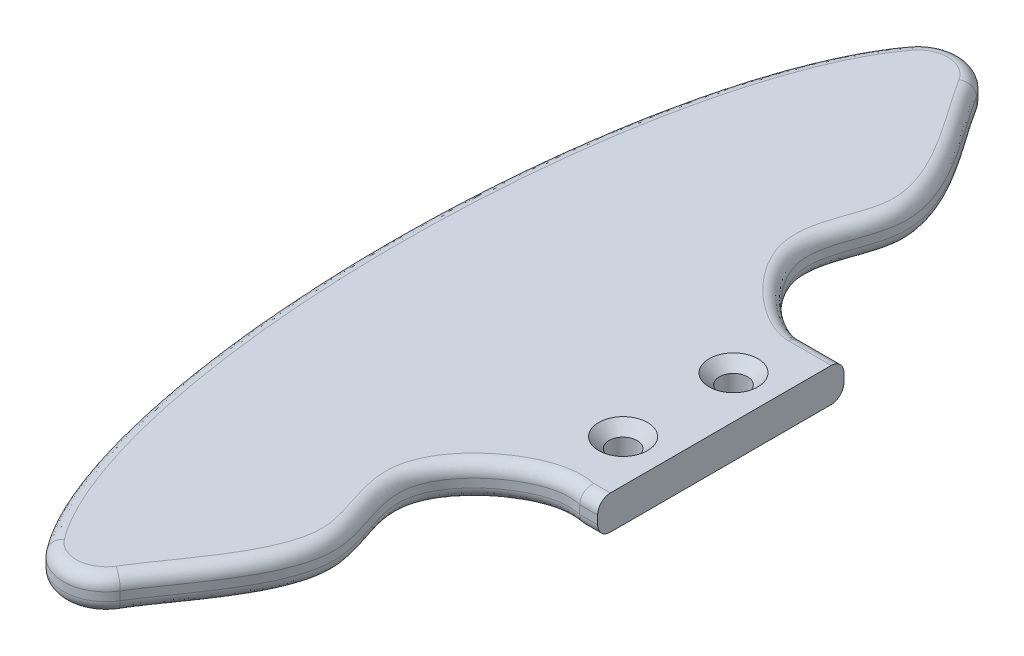
from build123d import *

# Parameters (mm, degrees)
BOSS_EXTRUDE1_DEPTH      = 4
CUT_EXTRUDE3_DEPTH       = 10
FILLET1_R                = 5
FILLET2_R                = 5
FILLET4_R                = 1.5
FILLET5_R                = 1.5
SKETCH8_R                = 1.65
M3_SCREWS_NO_ANGLE_DEPTH = 58.295865217


with BuildPart() as part:
    # Sketch1 → Boss-Extrude1 (new body)
    with BuildSketch(Plane(origin=(0, 0, 0), x_dir=(1, 0, 0), z_dir=(0, 1, 0))):
        with BuildLine():
            Line((16.880887403, -14.5), (21.880887403, -14.5))
            Line((21.880887403, -14.5), (21.880887403, 14.5))
            Line((21.880887403, 14.5), (16.880887403, 14.5))
            add(Edge.make_bspline(
                [(16.880887403, 14.5), (10.315205407, 90.001641988), (-10.061420815, 45.000820994), (-30.438047036, 0), (-10.061420815, -45.000820994), (10.315205407, -90.001641988), (16.880887403, -14.5)],
                knots=[1.837586327, 1.837586327, 1.837586327, 3.754121429, 3.754121429, 5.670656531, 5.670656531, 7.587191634, 7.587191634, 7.587191634], degree=2, weights=[1, 0.574938332, 1, 0.574938332, 1, 0.574938332, 1]))
        make_face()
    extrude(amount=BOSS_EXTRUDE1_DEPTH)

    # Sketch7 → Cut-Extrude3 (cut)
    with BuildSketch(Plane(origin=(0, 4, 0), x_dir=(1, 0, 0), z_dir=(0, 1, 0))):
        with BuildLine():
            add(Edge.make_bspline(
                [(23.14227403, 35.5), (18.099358539, 28.537011918), (23.696184015, 6.625507918), (4.306299207, 22.680417047), (15.57904794, 37.098876778), (-21.537333626, 68.37702066), (62.216195995, 43.763137081), (27.53995378, 41.57208107), (23.14227403, 35.5)],
                knots=[0, 0, 0, 0, 0.169799327, 0.265053464, 0.346195378, 0.531482099, 0.851926319, 1, 1, 1, 1], degree=3))
        make_face()
        with BuildLine():
            add(Edge.make_bspline(
                [(16.880887403, -14.5), (13.197509811, -15.298333146), (4.693966225, -22.34931788), (15.288323023, -37.415470802), (-20.663582176, -66.655050664), (50.291182714, -53.379177777), (30.243329399, -31.220630358), (25.186563856, -12.699832451), (16.880887403, -14.5)],
                knots=[0, 0, 0, 0, 0.097517699, 0.180587821, 0.370277586, 0.69833665, 0.78010659, 1, 1, 1, 1], degree=3))
        make_face()
    extrude(amount=-CUT_EXTRUDE3_DEPTH, mode=Mode.SUBTRACT)

    # Fillet1
    fillet1_edges = [part.edges().sort_by_distance(p)[0] for p in [
        (0, 2, -55),
    ]]
    fillet(fillet1_edges, radius=FILLET1_R)

    # Fillet2
    fillet2_edges = [part.edges().sort_by_distance(p)[0] for p in [
        (0, 2, 55),
    ]]
    fillet(fillet2_edges, radius=FILLET2_R)

    # Fillet4
    fillet4_edges = [part.edges().sort_by_distance(p)[0] for p in [
        (19.380887403, 4, -14.5),
        (20.828164004, 4, 14.5),
        (9.711911079, 4, 31.251065207),
        (-17.499993217, 4, -0.048425363),
        (9.677756323, 4, -31.292902199),
        (-2.456510296, 4, -52.795729821),
        (-2.484255438, 4, 52.73792317),
    ]]
    fillet(fillet4_edges, radius=FILLET4_R)

    # Fillet5
    fillet5_edges = [part.edges().sort_by_distance(p)[0] for p in [
        (20.828164004, 0, 14.5),
        (9.711911084, 0, 31.251065229),
        (-17.499993217, 0, -0.048425363),
        (9.677756314, 0, -31.292902088),
        (-2.456510296, 0, -52.795729821),
        (-2.484255438, 0, 52.73792317),
        (19.380887403, 0, -14.5),
    ]]
    fillet(fillet5_edges, radius=FILLET5_R)

    # Sketch8 → M3 Screws no Angle (cut, through all)
    with BuildSketch(Plane(origin=(0, 4, 0), x_dir=(1, 0, 0), z_dir=(0, 1, 0))):
        with Locations(Location((16.880887403, -6.5, 0), (0, 0, 270))):
            Circle(SKETCH8_R)
        with Locations(Location((16.880887403, 6.5, 0), (0, 0, 270))):
            Circle(SKETCH8_R)
    extrude(amount=-M3_SCREWS_NO_ANGLE_DEPTH, mode=Mode.SUBTRACT)

    # Cut-Extrude5 cone 1 section (through the dimple's axis) → Cut-Extrude5 (revolve, cut)
    with BuildSketch(Plane(origin=(16.880887403, 4, -6.5), x_dir=(0, 0, 1), z_dir=(1, 0, 0))):
        Polygon((0, 0), (2.875, 0), (0, 2.875), align=None)
    revolve(axis=Axis((16.880887403, 4, -6.5), (0, -1, 0)), mode=Mode.SUBTRACT)

    # Cut-Extrude5 cone 2 section (through the dimple's axis) → Cut-Extrude5 cone 2 (revolve, cut)
    with BuildSketch(Plane(origin=(16.880887403, 4, 6.5), x_dir=(0, 0, 1), z_dir=(1, 0, 0))):
        Polygon((0, 0), (2.875, 0), (0, 2.875), align=None)
    revolve(axis=Axis((16.880887403, 4, 6.5), (0, -1, 0)), mode=Mode.SUBTRACT)


solid = part.part
